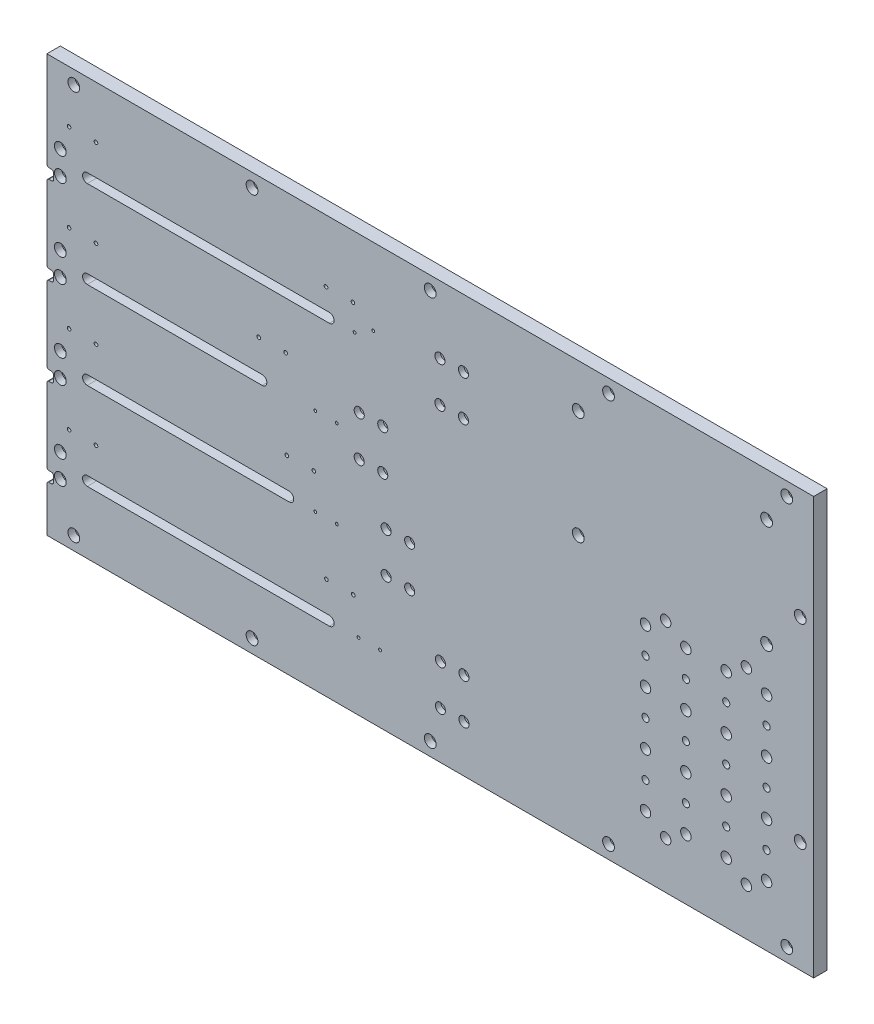
from build123d import *

# Parameters (mm, degrees)
SKETCH1_W                                        = 723.9
SKETCH1_H                                        = 393.7
BOSS_EXTRUDE1_DEPTH                              = 12.7
CUT_EXTRUDE1_DEPTH                               = 12.7
SKETCH5_W                                        = 6.35
SKETCH5_H                                        = 9.525
CUT_EXTRUDE2_DEPTH                               = 825.131172812
FILLET1_R                                        = 2.032
F_6_32_TAPPED_HOLE1_D                            = 2.7051
CBORE_FOR_1_4_SOCKET_HEAD_CAP_SCREW1_D           = 6.7564
CBORE_FOR_1_4_SOCKET_HEAD_CAP_SCREW1_CBORE_D     = 11.1125
CBORE_FOR_1_4_SOCKET_HEAD_CAP_SCREW1_CBORE_DEPTH = 6.731
SKETCH15_R                                       = 3.3655
SKETCH15_R_2                                     = 4.953
SKETCH15_R_3                                     = 4.7625
CUT_EXTRUDE9_DEPTH                               = 12.7
CBORE_FOR_1_4_SOCKET_HEAD_CAP_SCREW2_D           = 6.7564
CBORE_FOR_1_4_SOCKET_HEAD_CAP_SCREW2_CBORE_D     = 11.1125
CBORE_FOR_1_4_SOCKET_HEAD_CAP_SCREW2_CBORE_DEPTH = 6.731
F_6_32_TAPPED_HOLE2_D                            = 2.7051
CBORE_FOR_10_SOCKET_HEAD_CAP_SCREW1_D            = 5.1054
CBORE_FOR_10_SOCKET_HEAD_CAP_SCREW1_CBORE_D      = 9.525
CBORE_FOR_10_SOCKET_HEAD_CAP_SCREW1_CBORE_DEPTH  = 5.207
F_8_32_TAPPED_HOLE1_D                            = 3.4544
SKETCH28_R                                       = 3.3655
SKETCH28_R_2                                     = 3.302
CUT_EXTRUDE10_DEPTH                              = 825.131172812
SKETCH29_R                                       = 5.5626
CUT_EXTRUDE11_DEPTH                              = 6.731


with BuildPart() as part:
    # Sketch1 → Boss-Extrude1 (new body)
    with BuildSketch(Plane.XY):
        with Locations((361.95, -196.85)):
            Rectangle(SKETCH1_W, SKETCH1_H)
    extrude(amount=-BOSS_EXTRUDE1_DEPTH)

    # Sketch2 → Cut-Extrude1 (cut)
    with BuildSketch(Plane.XY):
        with BuildLine():
            Line((38.1, -78.105), (266.7, -78.105))
            ThreePointArc((266.7, -78.105), (271.145, -82.55), (266.7, -86.995))
            Line((266.7, -86.995), (38.1, -86.995))
            ThreePointArc((38.1, -86.995), (33.655, -82.55), (38.1, -78.105))
        make_face()
        with BuildLine():
            Line((38.1, -160.655), (203.2, -160.655))
            ThreePointArc((203.2, -160.655), (207.645, -165.1), (203.2, -169.545))
            Line((203.2, -169.545), (38.1, -169.545))
            ThreePointArc((38.1, -169.545), (33.655, -165.1), (38.1, -160.655))
        make_face()
        with BuildLine():
            Line((38.1, -243.205), (228.6, -243.205))
            ThreePointArc((228.6, -243.205), (233.045, -247.65), (228.6, -252.095))
            Line((228.6, -252.095), (38.1, -252.095))
            ThreePointArc((38.1, -252.095), (33.655, -247.65), (38.1, -243.205))
        make_face()
        with BuildLine():
            Line((38.1, -325.755), (266.7, -325.755))
            ThreePointArc((266.7, -325.755), (271.145, -330.2), (266.7, -334.645))
            Line((266.7, -334.645), (38.1, -334.645))
            ThreePointArc((38.1, -334.645), (33.655, -330.2), (38.1, -325.755))
        make_face()
    extrude(amount=-CUT_EXTRUDE1_DEPTH, mode=Mode.SUBTRACT)

    # Sketch5 → Cut-Extrude2 (cut, through all)
    with BuildSketch(Plane.XY):
        with Locations((3.175, -179.5375)):
            Rectangle(SKETCH5_W, SKETCH5_H)
        with Locations((3.175, -96.9875)):
            Rectangle(SKETCH5_W, SKETCH5_H)
        with Locations((3.175, -262.0875)):
            Rectangle(SKETCH5_W, SKETCH5_H)
        with Locations((3.175, -344.6375)):
            Rectangle(SKETCH5_W, SKETCH5_H)
    extrude(amount=-CUT_EXTRUDE2_DEPTH, mode=Mode.SUBTRACT)

    # Fillet1
    fillet1_edges = [part.edges().sort_by_distance(p)[0] for p in [
        (0, -349.4, -6.35),
        (0, -339.875, -6.35),
        (6.35, -339.875, -6.35),
        (6.35, -349.4, -6.35),
        (0, -266.85, -6.35),
        (0, -257.325, -6.35),
        (6.35, -257.325, -6.35),
        (6.35, -266.85, -6.35),
        (0, -101.75, -6.35),
        (0, -92.225, -6.35),
        (6.35, -92.225, -6.35),
        (6.35, -101.75, -6.35),
        (0, -184.3, -6.35),
        (0, -174.775, -6.35),
        (6.35, -174.775, -6.35),
        (6.35, -184.3, -6.35),
    ]]
    fillet(fillet1_edges, radius=FILLET1_R)

    # #6-32 Tapped Hole1 (through all)
    with Locations(Plane(origin=(0, 0, -12.7), x_dir=(-1, 0, 0), z_dir=(0, 0, -1))):
        with Locations((-20.955, -131.7625), (-46.355, -131.7625), (-46.355, -214.3125), (-20.955, -214.3125), (-46.355, -296.994599595), (-20.955, -296.994599595)):
            Hole(F_6_32_TAPPED_HOLE1_D / 2)

    # CBORE for 1/4 Socket Head Cap Screw1 (through all)
    with Locations(Plane.XY):
        with Locations((25.4, -381), (193.675, -381), (361.95, -381), (530.225, -381), (698.5, -381), (711.2, -288.925), (711.2, -104.775), (698.5, -12.7), (530.225, -12.7), (361.95, -12.7), (193.675, -12.7), (25.4, -12.7)):
            CounterBoreHole(CBORE_FOR_1_4_SOCKET_HEAD_CAP_SCREW1_D / 2, CBORE_FOR_1_4_SOCKET_HEAD_CAP_SCREW1_CBORE_D / 2, CBORE_FOR_1_4_SOCKET_HEAD_CAP_SCREW1_CBORE_DEPTH)

    # Sketch15 → Cut-Extrude9 (cut)
    with BuildSketch(Plane(origin=(0, 0, -12.7), x_dir=(-1, 0, 0), z_dir=(0, 0, -1))):
        with Locations(Location((-565.15, -209.55, 0), (0, 0, 180))):
            Circle(SKETCH15_R)
        with Locations(Location((-565.15, -184.15, 0), (0, 0, 180))):
            Circle(SKETCH15_R_2)
        with Locations(Location((-565.15, -234.95, 0), (0, 0, 180))):
            Circle(SKETCH15_R_2)
        with Locations(Location((-584.2, -171.45, 0), (0, 0, 180))):
            Circle(SKETCH15_R_2)
        with Locations(Location((-603.25, -184.15, 0), (0, 0, 180))):
            Circle(SKETCH15_R_2)
        with Locations(Location((-603.25, -209.55, 0), (0, 0, 180))):
            Circle(SKETCH15_R)
        with Locations(Location((-603.25, -234.95, 0), (0, 0, 180))):
            Circle(SKETCH15_R_2)
        with Locations(Location((-603.25, -260.35, 0), (0, 0, 180))):
            Circle(SKETCH15_R)
        with Locations(Location((-565.15, -260.35, 0), (0, 0, 180))):
            Circle(SKETCH15_R)
        with Locations(Location((-565.15, -285.75, 0), (0, 0, 180))):
            Circle(SKETCH15_R_3)
        with Locations(Location((-565.15, -311.15, 0), (0, 0, 180))):
            Circle(SKETCH15_R)
        with Locations(Location((-565.15, -336.55, 0), (0, 0, 180))):
            Circle(SKETCH15_R_2)
        with Locations(Location((-584.2, -349.25, 0), (0, 0, 180))):
            Circle(SKETCH15_R_2)
        with Locations(Location((-603.25, -336.55, 0), (0, 0, 180))):
            Circle(SKETCH15_R_2)
        with Locations(Location((-603.25, -311.15, 0), (0, 0, 180))):
            Circle(SKETCH15_R)
        with Locations(Location((-603.25, -285.75, 0), (0, 0, 180))):
            Circle(SKETCH15_R_2)
        with Locations(Location((-641.35, -184.15, 0), (0, 0, 180))):
            Circle(SKETCH15_R_2)
        with Locations(Location((-641.35, -209.55, 0), (0, 0, 180))):
            Circle(SKETCH15_R)
        with Locations(Location((-641.35, -234.95, 0), (0, 0, 180))):
            Circle(SKETCH15_R_2)
        with Locations(Location((-641.35, -260.35, 0), (0, 0, 180))):
            Circle(SKETCH15_R)
        with Locations(Location((-660.4, -171.45, 0), (0, 0, 180))):
            Circle(SKETCH15_R_2)
        with Locations(Location((-679.45, -184.15, 0), (0, 0, 180))):
            Circle(SKETCH15_R_2)
        with Locations(Location((-679.45, -209.55, 0), (0, 0, 180))):
            Circle(SKETCH15_R)
        with Locations(Location((-679.45, -234.95, 0), (0, 0, 180))):
            Circle(SKETCH15_R_2)
        with Locations(Location((-679.45, -260.35, 0), (0, 0, 180))):
            Circle(SKETCH15_R)
        with Locations(Location((-679.45, -285.75, 0), (0, 0, 180))):
            Circle(SKETCH15_R_2)
        with Locations(Location((-641.35, -285.75, 0), (0, 0, 180))):
            Circle(SKETCH15_R_2)
        with Locations(Location((-641.35, -311.15, 0), (0, 0, 180))):
            Circle(SKETCH15_R)
        with Locations(Location((-679.45, -311.15, 0), (0, 0, 180))):
            Circle(SKETCH15_R)
        with Locations(Location((-679.45, -336.55, 0), (0, 0, 180))):
            Circle(SKETCH15_R_2)
        with Locations(Location((-660.4, -349.25, 0), (0, 0, 180))):
            Circle(SKETCH15_R_2)
        with Locations(Location((-641.35, -336.55, 0), (0, 0, 180))):
            Circle(SKETCH15_R_2)
    extrude(amount=-CUT_EXTRUDE9_DEPTH, mode=Mode.SUBTRACT)

    # CBORE for 1/4 Socket Head Cap Screw2 (through all)
    with Locations(Plane.XY):
        with Locations((12.7, -319.0875), (12.7, -341.3125), (12.7, -258.7625), (12.7, -236.5375), (12.7, -176.2125), (12.7, -153.9875), (12.7, -93.6625), (12.7, -71.4375)):
            CounterBoreHole(CBORE_FOR_1_4_SOCKET_HEAD_CAP_SCREW2_D / 2, CBORE_FOR_1_4_SOCKET_HEAD_CAP_SCREW2_CBORE_D / 2, CBORE_FOR_1_4_SOCKET_HEAD_CAP_SCREW2_CBORE_DEPTH)

    # #6-32 Tapped Hole2 (through all)
    with Locations(Plane.XY):
        with Locations((253.365, -247.65), (273.685, -247.65), (253.365, -165.1), (273.685, -165.1), (290.480681693, -82.55), (308.078317898, -72.39), (294.24, -330.2), (314.56, -330.2)):
            Hole(F_6_32_TAPPED_HOLE2_D / 2)

    # CBORE for #10 Socket Head Cap Screw1 (through all)
    with Locations(Plane.XY):
        with Locations((371.075, -101.6), (393.3, -101.6), (393.3, -63.5), (371.075, -63.5), (317.1, -146.05), (294.875, -146.05), (294.875, -184.15), (317.1, -184.15), (320.275, -228.6), (342.5, -228.6), (342.5, -266.7), (320.275, -266.7), (371.530586253, -349.25), (393.755586253, -349.25), (393.755586253, -311.15), (371.530586253, -311.15)):
            CounterBoreHole(CBORE_FOR_10_SOCKET_HEAD_CAP_SCREW1_D / 2, CBORE_FOR_10_SOCKET_HEAD_CAP_SCREW1_CBORE_D / 2, CBORE_FOR_10_SOCKET_HEAD_CAP_SCREW1_CBORE_DEPTH)

    # #8-32 Tapped Hole1 (through all)
    with Locations(Plane(origin=(0, 0, -12.7), x_dir=(-1, 0, 0), z_dir=(0, 0, -1))):
        with Locations((-289.282858359, -297.6375), (-263.882858359, -297.6375), (-226.588522521, -215.0875), (-251.988522521, -215.0875), (-225.425, -131.7625), (-200.025, -131.7625), (-288.925, -58.7375), (-263.525, -58.7375), (-46.355, -49.2125), (-20.955, -49.2125), (-20.955, -131.7625), (-46.355, -131.7625), (-46.355, -214.3125), (-20.955, -214.3125), (-20.955, -296.994599595), (-46.355, -296.994599595)):
            Hole(F_8_32_TAPPED_HOLE1_D / 2)

    # Sketch28 → Cut-Extrude10 (cut, through all)
    with BuildSketch(Plane(origin=(0, 0, -12.7), x_dir=(-1, 0, 0), z_dir=(0, 0, -1))):
        with Locations((-501.65, -41.275)):
            Circle(SKETCH28_R)
        with Locations((-501.65, -142.875)):
            Circle(SKETCH28_R_2)
        with Locations((-679.45, -142.875)):
            Circle(SKETCH28_R)
        with Locations((-679.45, -41.275)):
            Circle(SKETCH28_R)
    extrude(amount=-CUT_EXTRUDE10_DEPTH, mode=Mode.SUBTRACT)

    # Sketch29 → Cut-Extrude11 (cut)
    with BuildSketch(Plane.XY):
        with Locations((501.65, -41.275)):
            Circle(SKETCH29_R)
        with Locations((501.65, -142.875)):
            Circle(SKETCH29_R)
        with Locations((679.45, -142.875)):
            Circle(SKETCH29_R)
        with Locations((679.45, -41.275)):
            Circle(SKETCH29_R)
    extrude(amount=-CUT_EXTRUDE11_DEPTH, mode=Mode.SUBTRACT)


solid = part.part
